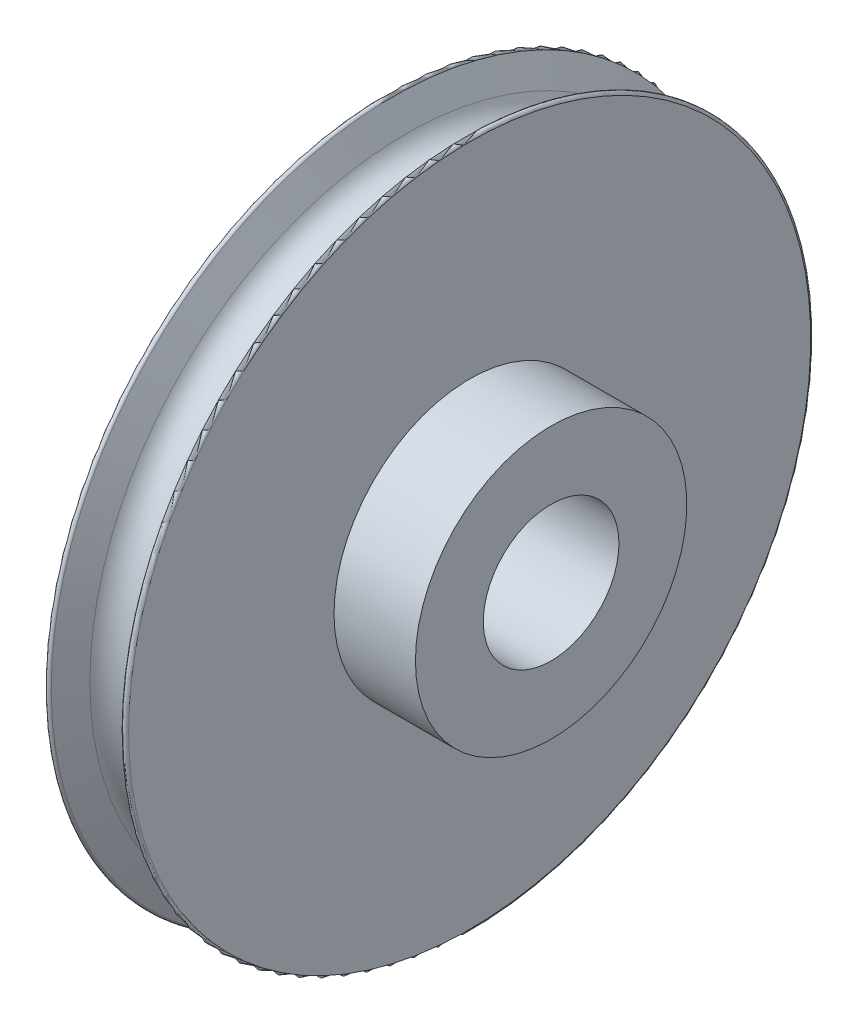
from build123d import *

# Parameters (mm, degrees)
FILLET1_R           = 0.127
SKETCH2_R           = 6.35
BOSS_EXTRUDE1_DEPTH = 3.81
SKETCH3_R           = 3.175
CUT_EXTRUDE1_DEPTH  = 24.992209055


with BuildPart() as part:
    # Sketch1 → Revolve1 (revolve)
    with BuildSketch(Plane.XY, mode=Mode.PRIVATE) as revolve1_sk:
        with BuildLine():
            Line((-1.905, 0), (-1.905, 16.51))
            Line((-1.905, 16.51), (-1.070224719, 14.797640449))
            ThreePointArc((-1.070224719, 14.797640449), (0, 14.12875), (1.070224719, 14.797640449))
            Line((1.070224719, 14.797640449), (1.905, 16.51))
            Line((1.905, 16.51), (1.905, 0))
            Line((1.905, 0), (-1.905, 0))
        make_face()
    revolve(revolve1_sk.sketch.rotate(Axis((-602.921612104, 0, 0), (1, 0, 0)), 90), axis=Axis((-602.921612104, 0, 0), (1, 0, 0)))

    # Fillet1
    fillet1_edges = [part.edges().sort_by_distance(p)[0] for p in [
        (1.905, 0, -16.51),
        (-1.905, 0, -16.51),
    ]]
    fillet(fillet1_edges, radius=FILLET1_R)

    # Sketch2 → Boss-Extrude1 (add)
    with BuildSketch(Plane(origin=(1.905, 0, 0), x_dir=(0, 0, -1), z_dir=(1, 0, 0))):
        with Locations(Location((0, 0, 0), (0, 0, 180))):
            Circle(SKETCH2_R)
    extrude(amount=BOSS_EXTRUDE1_DEPTH)

    # Sketch3 → Cut-Extrude1 (cut, through all)
    with BuildSketch(Plane(origin=(5.715, 0, 0), x_dir=(0, 0, -1), z_dir=(1, 0, 0))):
        Circle(SKETCH3_R)
    extrude(amount=-CUT_EXTRUDE1_DEPTH, mode=Mode.SUBTRACT)


solid = part.part
